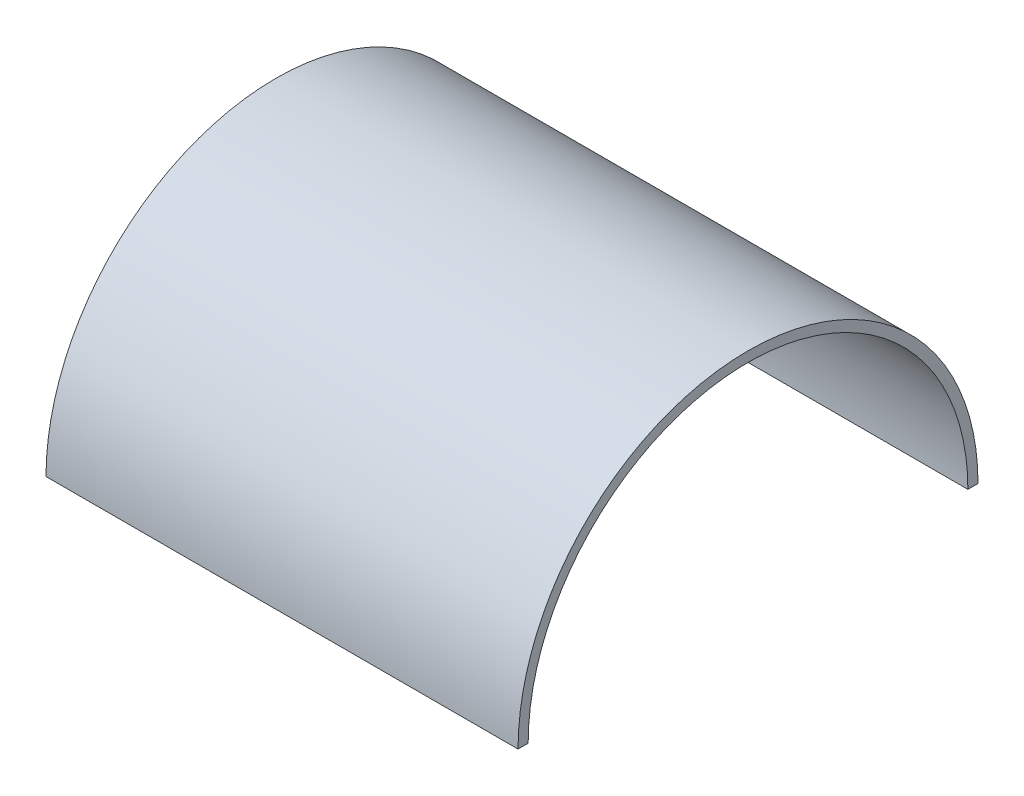
from build123d import *

# Parameters (mm, degrees)
EXTRUDE_THIN1_DEPTH = 118.618


with BuildPart() as part:
    # Sketch2 → Extrude-Thin1 (new body)
    with BuildSketch(Plane(origin=(0, 0, 0), x_dir=(0, 0, -1), z_dir=(1, 0, 0))):
        with BuildLine():
            ThreePointArc((0, 0), (57.78982039, 57.78982039), (115.579640779, 0))
            Line((115.579640779, 0), (113.039640779, 0))
            ThreePointArc((113.039640779, 0), (57.78982039, 55.24982039), (2.54, 0))
            Line((2.54, 0), (0, 0))
        make_face()
    extrude(amount=-EXTRUDE_THIN1_DEPTH)


solid = part.part
